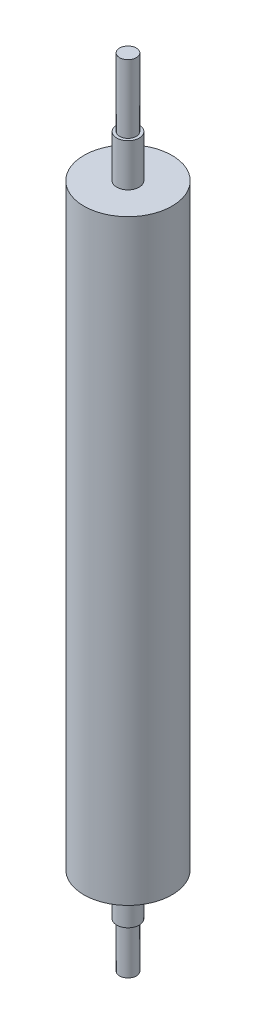
from build123d import *

# Parameters (mm, degrees)
SKETCH1_R            = 15.5
BOSS_EXTRUDE8_DEPTH  = 210
SKETCH1_9_R          = 3.95
BOSS_EXTRUDE9_DEPTH  = 15
BOSS_EXTRUDE10_START = -15
SKETCH1_10_R         = 2.95
BOSS_EXTRUDE10_DEPTH = 16
BOSS_EXTRUDE11_START = 225
SKETCH1_11_R         = 3.95
BOSS_EXTRUDE11_DEPTH = 15
BOSS_EXTRUDE12_START = 24
SKETCH2_R            = 2.95
BOSS_EXTRUDE12_DEPTH = 24


with BuildPart() as part:
    # Sketch1 → Boss-Extrude8 (new body)
    with BuildSketch(Plane(origin=(0, 0, 0), x_dir=(1, 0, 0), z_dir=(0, 1, 0))):
        with Locations(Location((0, 0, 0), (0, 0, 270))):
            Circle(SKETCH1_R)
    extrude(amount=BOSS_EXTRUDE8_DEPTH)

    # Sketch1<9> → Boss-Extrude9 (add)
    with BuildSketch(Plane(origin=(0, 0, 0), x_dir=(1, 0, 0), z_dir=(0, 1, 0))):
        with Locations(Location((0, 0, 0), (0, 0, 270))):
            Circle(SKETCH1_9_R)
    extrude(amount=-BOSS_EXTRUDE9_DEPTH)

    # Sketch1<10> → Boss-Extrude10 (add)
    with BuildSketch(Plane(origin=(0, 0, 0), x_dir=(1, 0, 0), z_dir=(0, 1, 0)).offset(BOSS_EXTRUDE10_START)):
        with Locations(Location((0, 0, 0), (0, 0, 270))):
            Circle(SKETCH1_10_R)
    extrude(amount=-BOSS_EXTRUDE10_DEPTH)

    # Sketch1<11> → Boss-Extrude11 (add)
    with BuildSketch(Plane(origin=(0, 0, 0), x_dir=(1, 0, 0), z_dir=(0, 1, 0)).offset(BOSS_EXTRUDE11_START)):
        with Locations(Location((0, 0, 0), (0, 0, 270))):
            Circle(SKETCH1_11_R)
    extrude(amount=-BOSS_EXTRUDE11_DEPTH)

    # Sketch2 → Boss-Extrude12 (add)
    with BuildSketch(Plane(origin=(0, 225, 0), x_dir=(1, 0, 0), z_dir=(0, 1, 0)).offset(BOSS_EXTRUDE12_START)):
        with Locations(Location((0, 0, 0), (0, 0, 270))):
            Circle(SKETCH2_R)
    extrude(amount=-BOSS_EXTRUDE12_DEPTH)


solid = part.part
